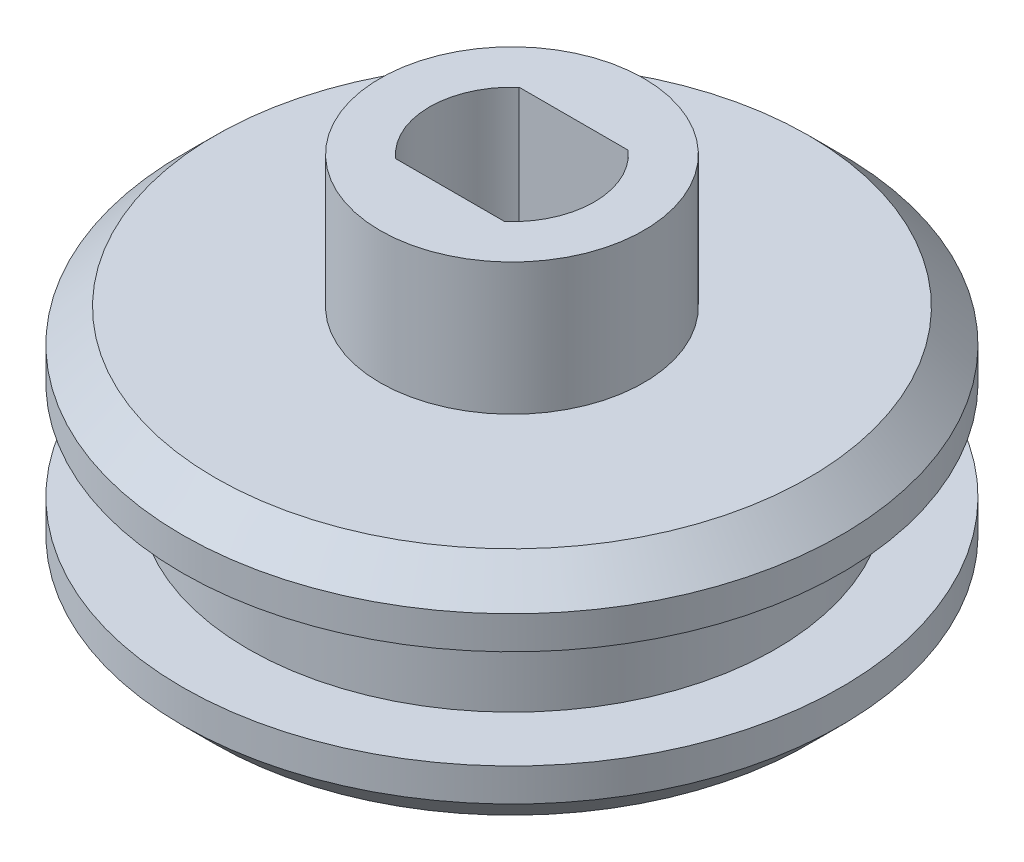
from build123d import *

# Parameters (mm, degrees)
CROQUIS1_R              = 10
SALIENTE_EXTRUIR1_DEPTH = 2
CROQUIS4_R              = 8
SALIENTE_EXTRUIR2_DEPTH = 3
CROQUIS5_R              = 10
SALIENTE_EXTRUIR3_DEPTH = 2
CHAFL_N1_SIZE           = 1
CHAFL_N2_SIZE           = 1
CROQUIS7_R              = 4
SALIENTE_EXTRUIR4_DEPTH = 4
CORTAR_EXTRUIR1_DEPTH   = 16.779733838
CROQUIS8_R              = 1
CORTAR_EXTRUIR2_DEPTH   = 18.916472867
CROQUIS9_R              = 2.5
CORTAR_EXTRUIR3_DEPTH   = 5


with BuildPart() as part:
    # Croquis1 → Saliente-Extruir1 (new body)
    with BuildSketch(Plane(origin=(0, 0, 0), x_dir=(1, 0, 0), z_dir=(0, 1, 0))):
        with Locations(Location((0, 0, 0), (0, 0, 270))):
            Circle(CROQUIS1_R)
    extrude(amount=SALIENTE_EXTRUIR1_DEPTH)

    # Croquis4 → Saliente-Extruir2 (add)
    with BuildSketch(Plane(origin=(0, 2, 0), x_dir=(1, 0, 0), z_dir=(0, 1, 0))):
        with Locations(Location((0, 0, 0), (0, 0, 270))):
            Circle(CROQUIS4_R)
    extrude(amount=SALIENTE_EXTRUIR2_DEPTH)

    # Croquis5 → Saliente-Extruir3 (add)
    with BuildSketch(Plane(origin=(0, 5, 0), x_dir=(1, 0, 0), z_dir=(0, 1, 0))):
        with Locations(Location((0, 0, 0), (0, 0, 270))):
            Circle(CROQUIS5_R)
    extrude(amount=SALIENTE_EXTRUIR3_DEPTH)

    # Chaflán1
    chafl_n1_edges = [part.edges().sort_by_distance(p)[0] for p in [
        (0, 7, -10),
    ]]
    chamfer(chafl_n1_edges, length=CHAFL_N1_SIZE)

    # Chaflán2
    chafl_n2_edges = [part.edges().sort_by_distance(p)[0] for p in [
        (0, 0, -10),
    ]]
    chamfer(chafl_n2_edges, length=CHAFL_N2_SIZE)

    # Croquis7 → Saliente-Extruir4 (add)
    with BuildSketch(Plane(origin=(0, 7, 0), x_dir=(1, 0, 0), z_dir=(0, 1, 0))):
        with Locations(Location((0, 0, 0), (0, 0, 270))):
            Circle(CROQUIS7_R)
    extrude(amount=SALIENTE_EXTRUIR4_DEPTH)

    # Croquis6 → Cortar-Extruir1 (cut, through all)
    with BuildSketch(Plane(origin=(0, 7, 0), x_dir=(1, 0, 0), z_dir=(0, 1, 0))):
        with BuildLine():
            Line((-1.653594569, -1.875), (1.653594569, -1.875))
            ThreePointArc((1.653594569, -1.875), (2.5, 0), (1.653594569, 1.875))
            Line((1.653594569, 1.875), (-1.653594569, 1.875))
            ThreePointArc((-1.653594569, 1.875), (-2.5, 0), (-1.653594569, -1.875))
        make_face()
    extrude(amount=CORTAR_EXTRUIR1_DEPTH, mode=Mode.SUBTRACT)

    # Croquis8 → Cortar-Extruir2 (cut, through all)
    with BuildSketch(Plane.XZ):
        with Locations(Location((0, 0, 0), (0, 0, 270))):
            Circle(CROQUIS8_R)
    extrude(amount=-CORTAR_EXTRUIR2_DEPTH, mode=Mode.SUBTRACT)

    # Croquis9 → Cortar-Extruir3 (cut)
    with BuildSketch(Plane.XZ):
        with Locations(Location((0, 0, 0), (0, 0, 270))):
            Circle(CROQUIS9_R)
    extrude(amount=-CORTAR_EXTRUIR3_DEPTH, mode=Mode.SUBTRACT)


solid = part.part
